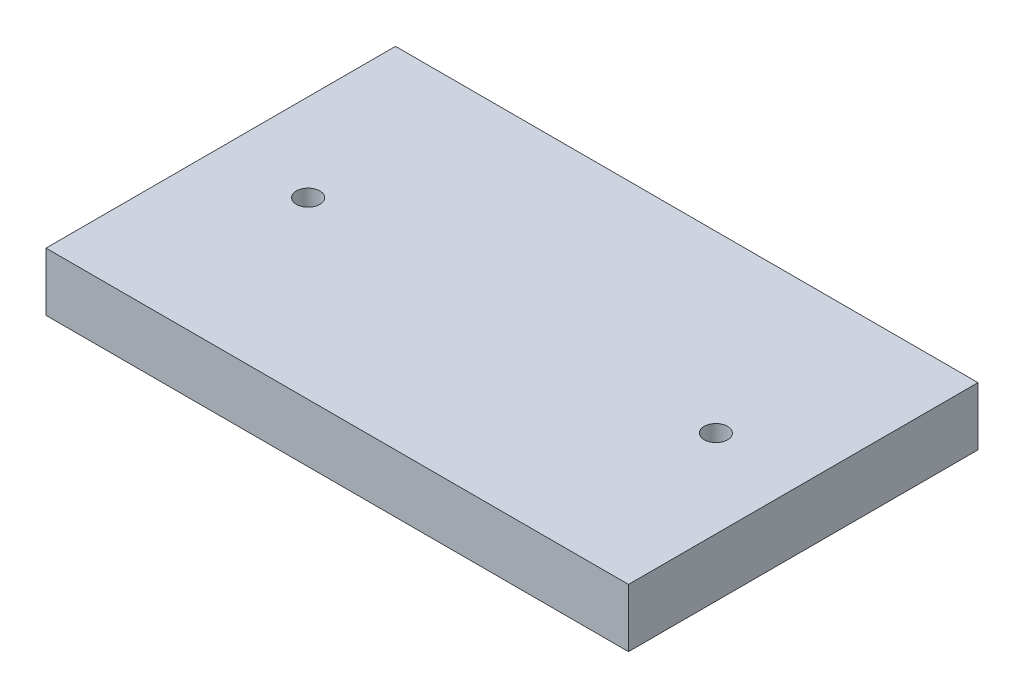
from build123d import *

# Parameters (mm, degrees)
SKETCH1_W                                       = 127
SKETCH1_H                                       = 76.2
BOSS_EXTRUDE1_DEPTH                             = 12.7
CBORE_FOR_10_SOCKET_HEAD_CAP_SCREW1_D           = 5.1054
CBORE_FOR_10_SOCKET_HEAD_CAP_SCREW1_CBORE_D     = 9.525
CBORE_FOR_10_SOCKET_HEAD_CAP_SCREW1_CBORE_DEPTH = 4.826


with BuildPart() as part:
    # Sketch1 → Boss-Extrude1 (new body)
    with BuildSketch(Plane(origin=(0, 0, 0), x_dir=(1, 0, 0), z_dir=(0, 1, 0))):
        with Locations((63.5, 38.1)):
            Rectangle(SKETCH1_W, SKETCH1_H)
    extrude(amount=BOSS_EXTRUDE1_DEPTH)

    # CBORE for #10 Socket Head Cap Screw1 (through all)
    with Locations(Plane(origin=(0, 0, 0), x_dir=(-1, 0, 0), z_dir=(0, -1, 0))):
        with Locations((-19.05, 38.1), (-107.95, 38.1)):
            CounterBoreHole(CBORE_FOR_10_SOCKET_HEAD_CAP_SCREW1_D / 2, CBORE_FOR_10_SOCKET_HEAD_CAP_SCREW1_CBORE_D / 2, CBORE_FOR_10_SOCKET_HEAD_CAP_SCREW1_CBORE_DEPTH)


solid = part.part
